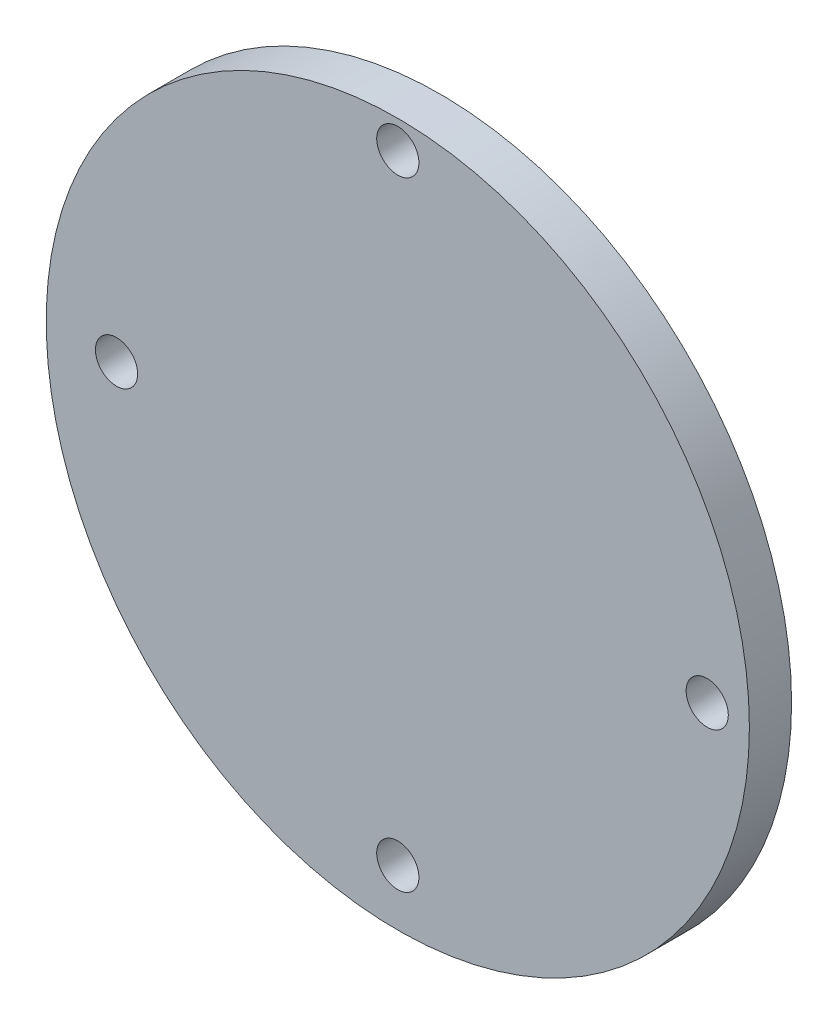
from build123d import *

# Parameters (mm, degrees)
SZKIC1_R                        = 25
DODANIE_WYCI_GNI_CIE1_DEPTH     = 3
SZKIC2_R                        = 5
SZKIC2_R_2                      = 2.5
DODANIE_WYCI_GNI_CIE2_DEPTH     = 12
WYTNIJ_WYCI_GNI_CIE1_REACH      = 39.336
WYTNIJ_WYCI_GNI_CIE1_END_RADIUS = 5
SZKIC3_R                        = 1.25
WYTNIJ_WYCI_GNI_CIE2_REACH      = 40.406
SZKIC4_R                        = 1.5


with BuildPart() as part:
    # Szkic1 → Dodanie-wyciągnięcie1 (new body)
    with BuildSketch(Plane.XY):
        Circle(SZKIC1_R)
    extrude(amount=DODANIE_WYCI_GNI_CIE1_DEPTH)

    # Szkic2 → Dodanie-wyciągnięcie2 (add)
    with BuildSketch(Plane(origin=(0, 0, 0), x_dir=(-1, 0, 0), z_dir=(0, 0, -1))):
        Circle(SZKIC2_R)
        Circle(SZKIC2_R_2, mode=Mode.SUBTRACT)
    extrude(amount=DODANIE_WYCI_GNI_CIE2_DEPTH)

    # Wytnij-wyciągnięcie1: up to this cylinder (the profile starts inside it)
    wytnij_wyci_gni_cie1_end = Plane(origin=(0, 0, -6), z_dir=(0, 0, 1)) * Cylinder(WYTNIJ_WYCI_GNI_CIE1_END_RADIUS, 89.672, mode=Mode.PRIVATE)
    # Szkic3 → Wytnij-wyciągnięcie1 (cut, up to the surface)
    with BuildSketch(Plane(origin=(0, 0, 0), x_dir=(1, 0, 0), z_dir=(0, 1, 0)), mode=Mode.PRIVATE) as wytnij_wyci_gni_cie1_sk1:
        with Locations(Location((0, 6, 0), (0, 0, 90))):
            Circle(SZKIC3_R)
    wytnij_wyci_gni_cie1_tool1 = extrude(wytnij_wyci_gni_cie1_sk1.sketch, amount=WYTNIJ_WYCI_GNI_CIE1_REACH, mode=Mode.PRIVATE) & wytnij_wyci_gni_cie1_end
    add(wytnij_wyci_gni_cie1_tool1.solids().sort_by_distance((0, 0, -6))[0], mode=Mode.SUBTRACT)

    # Szkic4 → Wytnij-wyciągnięcie2 (cut, up to next)
    with BuildSketch(Plane.XY.offset(3), mode=Mode.PRIVATE) as wytnij_wyci_gni_cie2_sk1:
        with Locations((22, 0)):
            Circle(SZKIC4_R)
    wytnij_wyci_gni_cie2_tool1 = extrude(wytnij_wyci_gni_cie2_sk1.sketch, amount=-WYTNIJ_WYCI_GNI_CIE2_REACH, mode=Mode.PRIVATE) & part.part
    # Szkic4 → Wytnij-wyciągnięcie2 (cut, up to next)
    with BuildSketch(Plane.XY.offset(3), mode=Mode.PRIVATE) as wytnij_wyci_gni_cie2_sk2:
        with Locations((-20, 0)):
            Circle(SZKIC4_R)
    wytnij_wyci_gni_cie2_tool2 = extrude(wytnij_wyci_gni_cie2_sk2.sketch, amount=-WYTNIJ_WYCI_GNI_CIE2_REACH, mode=Mode.PRIVATE) & part.part
    # Szkic4 → Wytnij-wyciągnięcie2 (cut, up to next)
    with BuildSketch(Plane.XY.offset(3), mode=Mode.PRIVATE) as wytnij_wyci_gni_cie2_sk3:
        with Locations((0, -21)):
            Circle(SZKIC4_R)
    wytnij_wyci_gni_cie2_tool3 = extrude(wytnij_wyci_gni_cie2_sk3.sketch, amount=-WYTNIJ_WYCI_GNI_CIE2_REACH, mode=Mode.PRIVATE) & part.part
    # Szkic4 → Wytnij-wyciągnięcie2 (cut, up to next)
    with BuildSketch(Plane.XY.offset(3), mode=Mode.PRIVATE) as wytnij_wyci_gni_cie2_sk4:
        with Locations((0, 23)):
            Circle(SZKIC4_R)
    wytnij_wyci_gni_cie2_tool4 = extrude(wytnij_wyci_gni_cie2_sk4.sketch, amount=-WYTNIJ_WYCI_GNI_CIE2_REACH, mode=Mode.PRIVATE) & part.part
    add(wytnij_wyci_gni_cie2_tool1.solids().sort_by_distance((22, 0, 3))[0], mode=Mode.SUBTRACT)
    add(wytnij_wyci_gni_cie2_tool2.solids().sort_by_distance((-20, 0, 3))[0], mode=Mode.SUBTRACT)
    add(wytnij_wyci_gni_cie2_tool3.solids().sort_by_distance((0, -21, 3))[0], mode=Mode.SUBTRACT)
    add(wytnij_wyci_gni_cie2_tool4.solids().sort_by_distance((0, 23, 3))[0], mode=Mode.SUBTRACT)


solid = part.part
